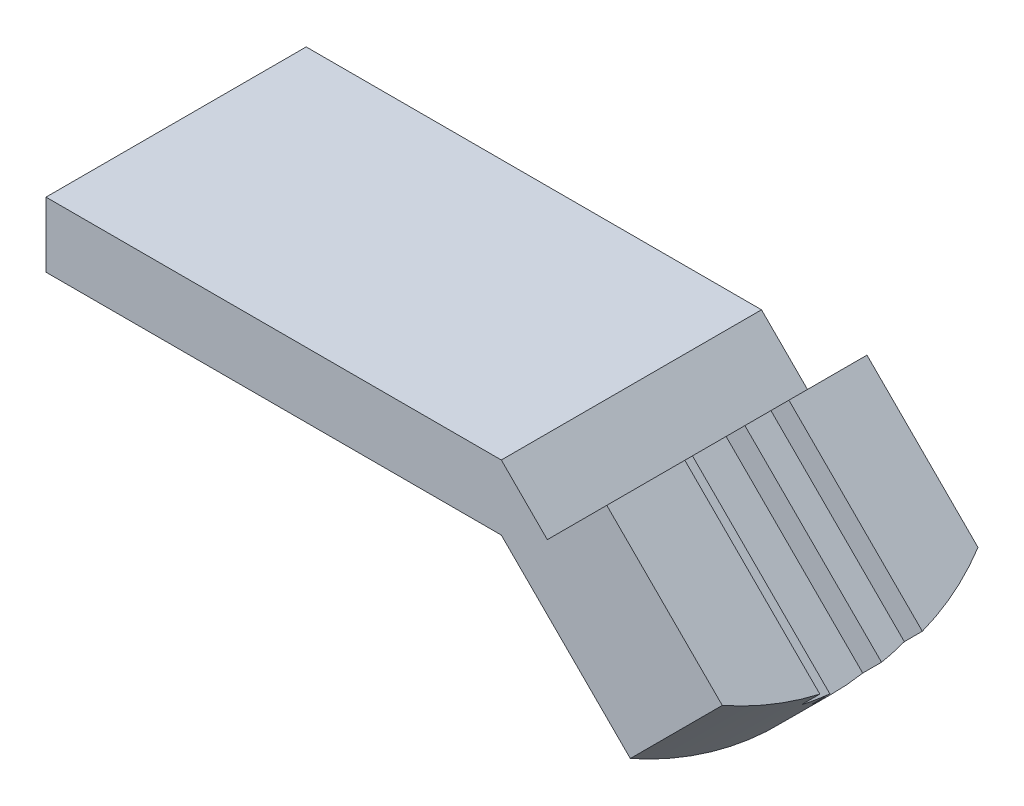
from build123d import *

# Parameters (mm, degrees)
BOSS_EXTRUDE1_DEPTH     = 20
CUT_EXTRUDE3_DEPTH      = 50.867148527
CUT_EXTRUDE3_DEPTH_BACK = 50.867148527
CUT_EXTRUDE4_DEPTH      = 51.602966037
CUT_EXTRUDE4_DEPTH_BACK = 51.602966037


with BuildPart() as part:
    # Sketch1 → Boss-Extrude1 (new body)
    with BuildSketch(Plane.XY):
        Polygon((0, 0), (35, 0), (46.642135624, -11.642135624), (53.713203436, -4.571067812), (43.106601718, 6.035533906), (38.535533906, 1.464466094), (35, 5), (0, 5), align=None)
    extrude(amount=BOSS_EXTRUDE1_DEPTH)

    # Sketch2 → Cut-Extrude3 (cut, two sides: drawn at the far end of the back side and taken through both)
    with BuildSketch(Plane(origin=(29.142135624, -29.142135624, 0), x_dir=(0, 0, -1), z_dir=(0.7071067811865479, -0.7071067811865471, 0)).offset(-CUT_EXTRUDE3_DEPTH_BACK)):
        Polygon((-14, 135.155901118), (-14, 34.748737342), (-14, 32.748737342), (-12, 32.748737342), (-12, 30.748737342), (-8, 30.748737342), (-8, 32.792627222), (-6, 32.792627222), (-6, 34.748737342), (-6, 135.155901118), (-6, 335.970228672), (-14, 335.970228672), align=None)
    extrude(amount=CUT_EXTRUDE3_DEPTH + CUT_EXTRUDE3_DEPTH_BACK, mode=Mode.SUBTRACT)

    # Sketch4 → Cut-Extrude4 (cut, two sides: drawn at the far end of the back side and taken through both)
    with BuildSketch(Plane(origin=(24.571067812, 24.571067812, 0), x_dir=(0, 0, -1), z_dir=(0.7071067811865477, 0.7071067811865475, 0)).offset(-CUT_EXTRUDE4_DEPTH_BACK)):
        with BuildLine():
            Line((89.549076457, 16.380836563), (0, -38.283901601))
            ThreePointArc((0, -38.283901601), (-9.934867623, -41.207301416), (-20, -38.769890621))
            Line((-20, -38.769890621), (-112.098466498, 11.480911975))
            Line((-112.098466498, 11.480911975), (-107.001191072, -198.288248186))
            Line((-107.001191072, -198.288248186), (94.646351884, -193.388323598))
            Line((94.646351884, -193.388323598), (89.549076457, 16.380836563))
        make_face()
    extrude(amount=CUT_EXTRUDE4_DEPTH + CUT_EXTRUDE4_DEPTH_BACK, mode=Mode.SUBTRACT)


solid = part.part
